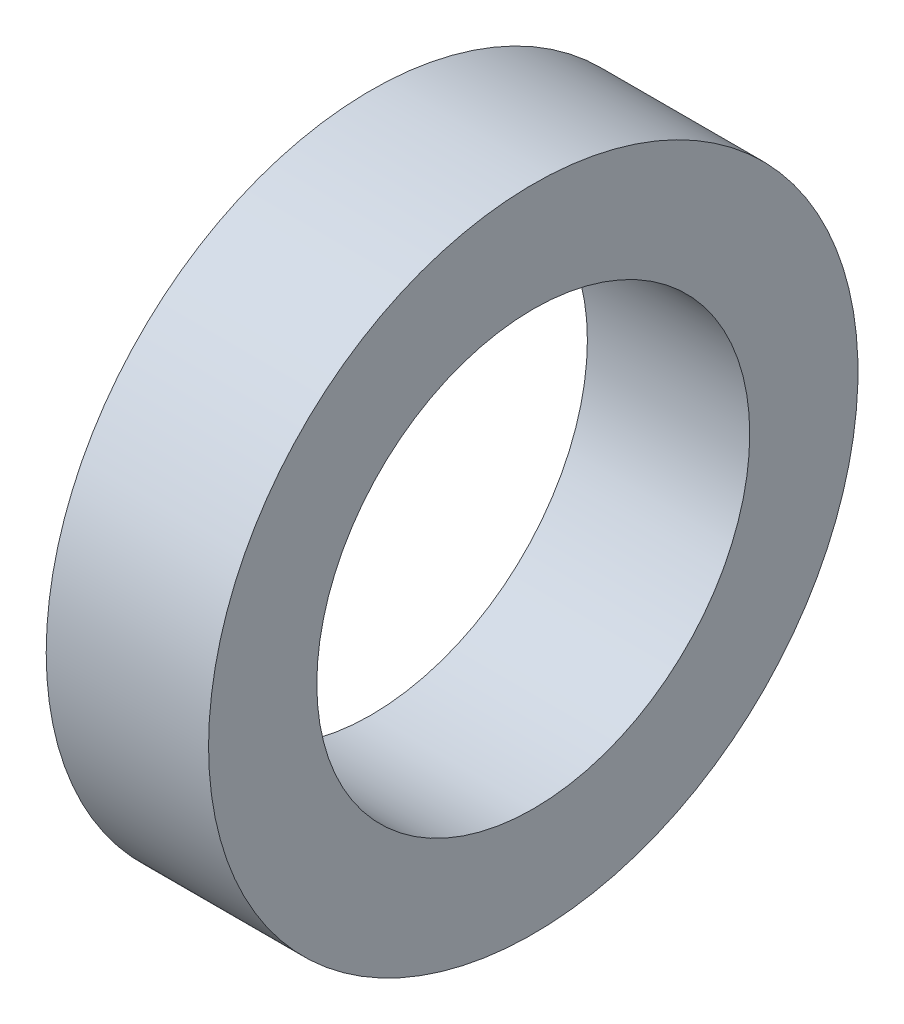
from build123d import *

# Parameters (mm, degrees)
ESQUISSE1_W = 3
ESQUISSE1_H = 2


with BuildPart() as part:
    # joint: sweep along a path in Esquisse2
    with BuildLine(Plane(origin=(0, 0, 0), x_dir=(0, 0, -1), z_dir=(1, 0, 0))) as joint_path:
        CenterArc((0, -4), 4, 0, 360)
    # Esquisse1 → joint (sweep)
    with BuildSketch(Plane.XY):
        with Locations((-1.5, 1)):
            Rectangle(ESQUISSE1_W, ESQUISSE1_H)
    sweep(path=joint_path.line)


solid = part.part
